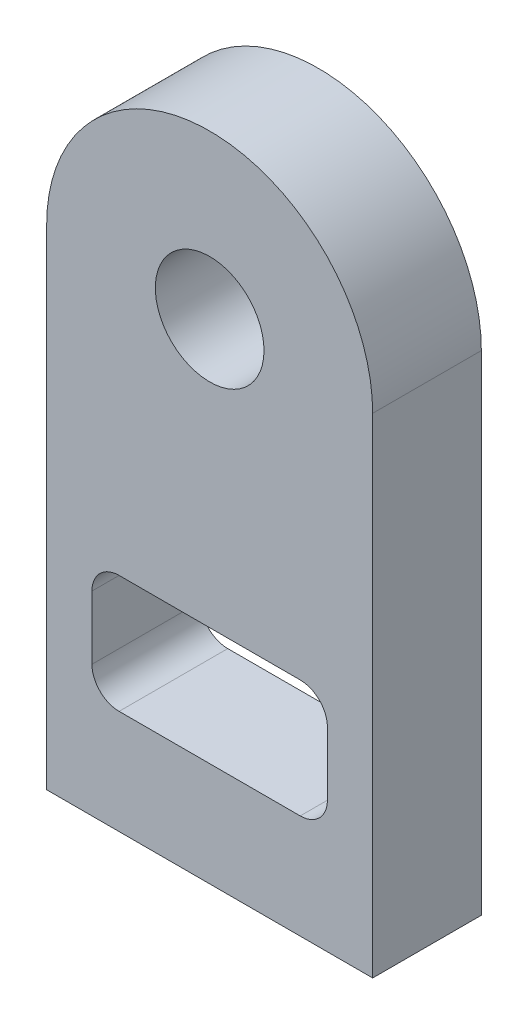
from build123d import *

# Parameters (mm, degrees)
MODEL_R                 = 1.5
SALIENTE_EXTRUIR1_DEPTH = 3


with BuildPart() as part:
    # Model → Saliente-Extruir1 (new body)
    with BuildSketch(Plane.XY):
        with BuildLine():
            Line((159.591356547, 212.494036843), (159.591356547, 198.994036843))
            Line((159.591356547, 198.994036843), (150.591356547, 198.994036843))
            Line((150.591356547, 198.994036843), (150.591356547, 212.494036843))
            ThreePointArc((150.591356547, 212.494036843), (155.091356547, 216.994036843), (159.591356547, 212.494036843))
        make_face()
        with Locations((155.091356547, 212.494036843)):
            Circle(MODEL_R, mode=Mode.SUBTRACT)
        with BuildLine():
            Line((157.591356547, 201.869036843), (152.591356547, 201.869036843))
            ThreePointArc((152.591356547, 201.869036843), (152.061026462, 202.088706757), (151.841356547, 202.619036843))
            Line((151.841356547, 202.619036843), (151.841356547, 204.369036843))
            ThreePointArc((151.841356547, 204.369036843), (152.061026462, 204.899366929), (152.591356547, 205.119036843))
            Line((152.591356547, 205.119036843), (157.591356547, 205.119036843))
            ThreePointArc((157.591356547, 205.119036843), (158.121686633, 204.899366929), (158.341356547, 204.369036843))
            Line((158.341356547, 204.369036843), (158.341356547, 202.619036843))
            ThreePointArc((158.341356547, 202.619036843), (158.121686633, 202.088706757), (157.591356547, 201.869036843))
        make_face(mode=Mode.SUBTRACT)
    extrude(amount=SALIENTE_EXTRUIR1_DEPTH)


solid = part.part
